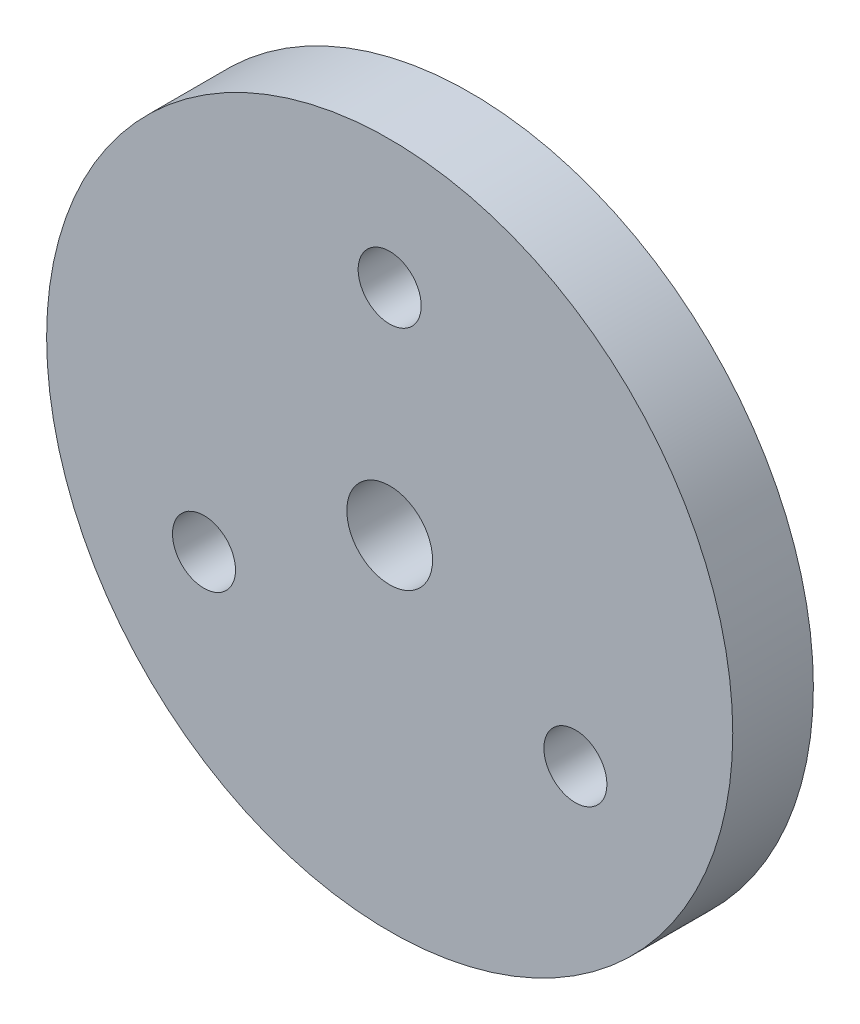
from build123d import *

# Parameters (mm, degrees)
SKETCH1_R               = 50.8
TOP_PLATE_DEPTH         = 11.938
SKETCH2_R               = 6.35
CENTRAL_HOLE_DEPTH      = 73.82716419
SKETCH3_R               = 4.66627796
BALL_HOLE_DEPTH         = 11.938
BALL_HOLE_PATTERN_COUNT = 3


with BuildPart() as part:
    # Sketch1 → top_plate (new body)
    with BuildSketch(Plane.XY):
        Circle(SKETCH1_R)
    extrude(amount=TOP_PLATE_DEPTH)

    # Sketch2 → central_hole (cut, through all)
    with BuildSketch(Plane.XY.offset(11.938)):
        Circle(SKETCH2_R)
    extrude(amount=-CENTRAL_HOLE_DEPTH, mode=Mode.SUBTRACT)

    # Sketch3 → ball_hole (cut)
    with BuildSketch(Plane.XY.offset(11.938)):
        with Locations((0, 31.75)):
            Circle(SKETCH3_R)
    ball_hole = extrude(amount=-BALL_HOLE_DEPTH, mode=Mode.SUBTRACT)

    # ball_hole_pattern: ball_hole ×3 about axis
    ball_hole_pattern_axis = Axis((0, 0, 0), (0, 0, 1))
    for i in range(1, BALL_HOLE_PATTERN_COUNT):
        add(ball_hole.rotate(ball_hole_pattern_axis, i * 360 / BALL_HOLE_PATTERN_COUNT), mode=Mode.SUBTRACT)


solid = part.part
